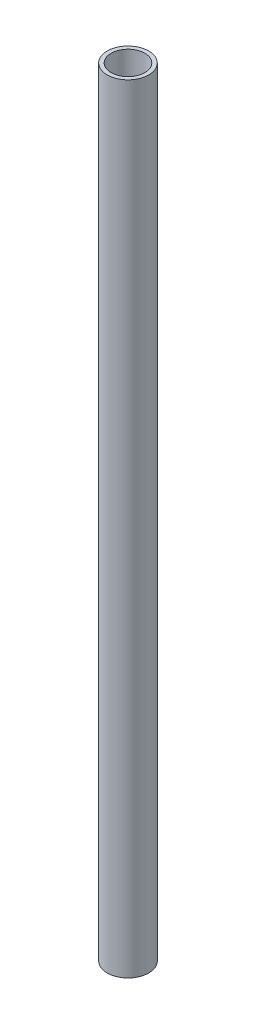
from build123d import *

# Parameters (mm, degrees)
CROQUIS_TUBO_R   = 8
CROQUIS_TUBO_R_2 = 6.5
TUBO_DEPTH       = 300


with BuildPart() as part:
    # Croquis_tubo → Tubo (new body)
    with BuildSketch(Plane(origin=(0, 0, 0), x_dir=(1, 0, 0), z_dir=(0, 1, 0))):
        with Locations(Location((0, 0, 0), (0, 0, 270))):
            Circle(CROQUIS_TUBO_R)
        with Locations(Location((0, 0, 0), (0, 0, 270))):
            Circle(CROQUIS_TUBO_R_2, mode=Mode.SUBTRACT)
    extrude(amount=TUBO_DEPTH)


solid = part.part
